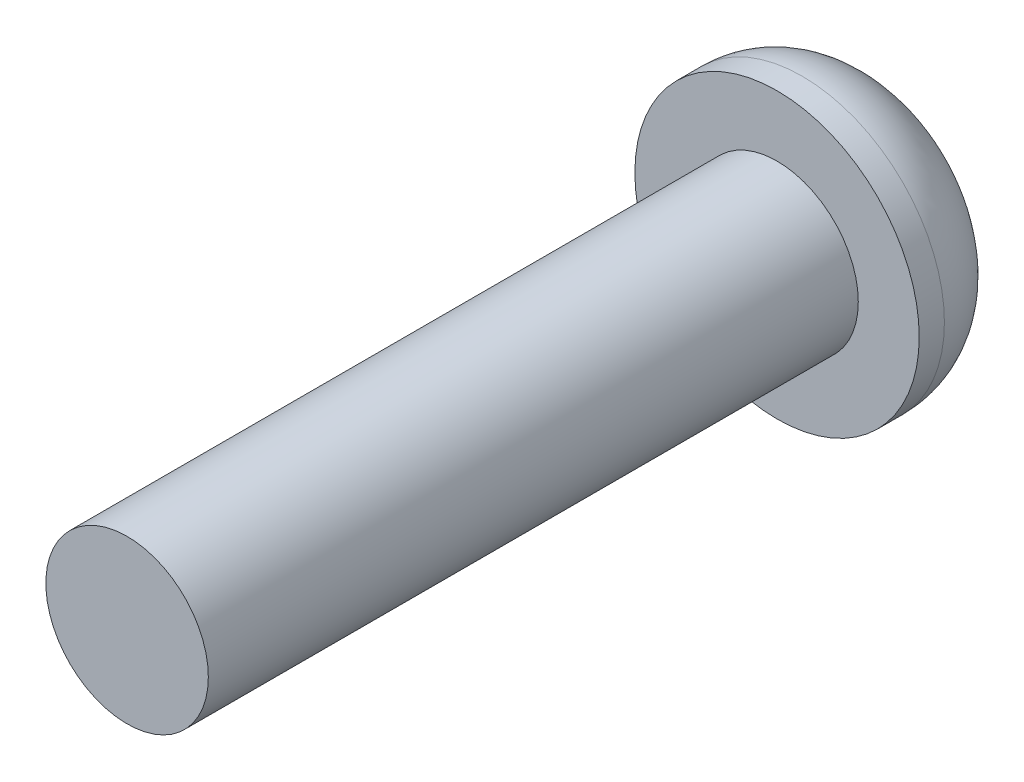
from build123d import *

# Parameters (mm, degrees)
SKETCH_1_R      = 1
EXTRUDE_1_DEPTH = 8
SKETCH_2_R      = 1.75
EXTRUDE_2_DEPTH = 1.31
FILLET_2_R      = 1


with BuildPart() as part:
    # 草图1 → 凸台-拉伸1 (new body)
    with BuildSketch(Plane.XY):
        Circle(SKETCH_1_R)
    extrude(amount=EXTRUDE_1_DEPTH)

    # 草图2 → 凸台-拉伸2 (add)
    with BuildSketch(Plane(origin=(0, 0, 0), x_dir=(-1, 0, 0), z_dir=(0, 0, -1))):
        Circle(SKETCH_2_R)
    extrude(amount=EXTRUDE_2_DEPTH)

    # 圆角2
    fillet_2_edges = [part.edges().sort_by_distance(p)[0] for p in [
        (1.75, 0, -1.31),
    ]]
    fillet(fillet_2_edges, radius=FILLET_2_R)


solid = part.part
